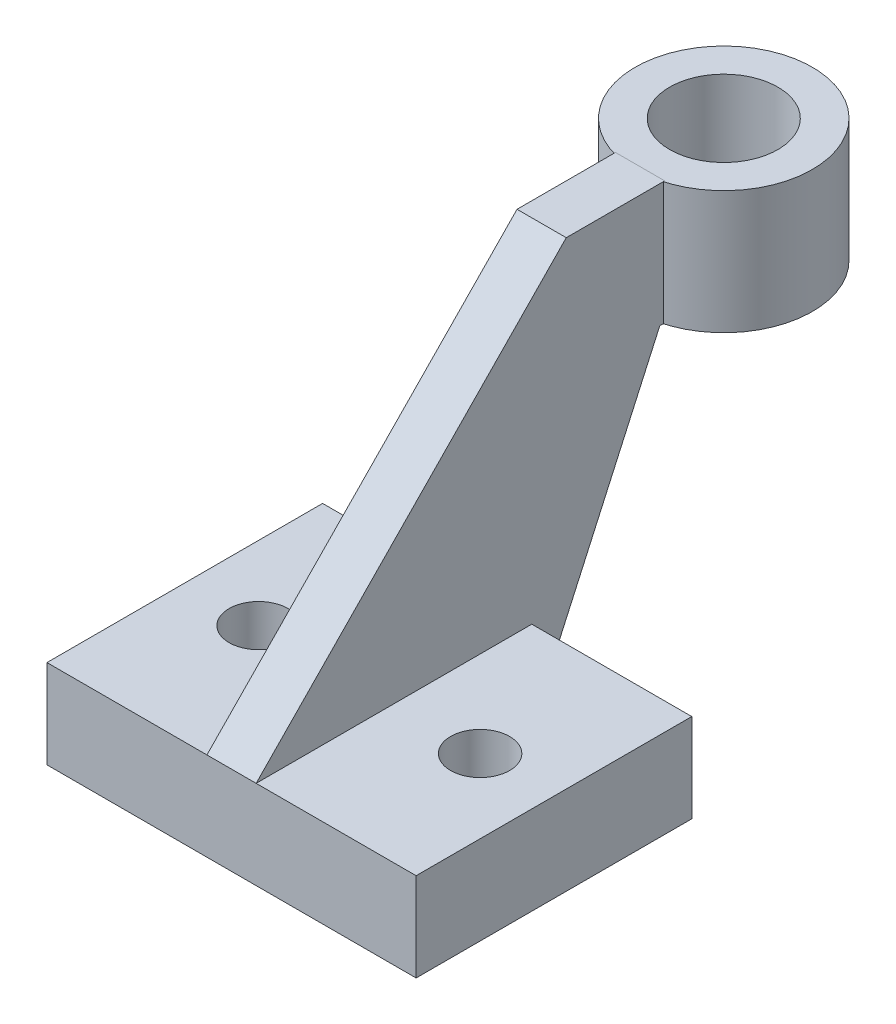
from build123d import *

# Parameters (mm, degrees)
SKETCH1_W           = 56
SKETCH1_H           = 18
BOSS_EXTRUDE1_DEPTH = 37.5
SKETCH3_R           = 18
SKETCH3_R_2         = 11
BOSS_EXTRUDE2_DEPTH = 12.5
BOSS_EXTRUDE3_DEPTH = 5
SKETCH6_W           = 6
SKETCH6_H           = 18.001


with BuildPart() as part:
    # Sketch1 → Boss-Extrude1 (new, symmetric)
    with BuildSketch(Plane(origin=(0, 0, 0), x_dir=(0, 0, -1), z_dir=(1, 0, 0))):
        with Locations((0, 9)):
            Rectangle(SKETCH1_W, SKETCH1_H)
    extrude(amount=BOSS_EXTRUDE1_DEPTH, both=True)

    # Sketch4 → Boss-Extrude3 (add, symmetric)
    with BuildSketch(Plane(origin=(0, 0, 0), x_dir=(0, 0, -1), z_dir=(1, 0, 0))):
        Polygon((-28, 18), (35, 82.5), (55, 82.5), (55, 57.5), (54, 57.5), (28, 0), (28, 18), align=None)
    extrude(amount=BOSS_EXTRUDE3_DEPTH, both=True)

    # Sketch6 → Hole1 (revolve, cut)
    with BuildSketch(Plane(origin=(-22.5, 18, 0), x_dir=(0, 0, 1), z_dir=(1, 0, 0))):
        with Locations((3, 9.0005)):
            Rectangle(SKETCH6_W, SKETCH6_H)
    hole1 = revolve(axis=Axis((-22.5, -92, 0), (0, 1, 0)), mode=Mode.SUBTRACT)

    # Mirror1: Hole1 across plane
    add(hole1.mirror(Plane(origin=(0, 0, 0), x_dir=(0, 0, 1), z_dir=(1, 0, 0))), mode=Mode.SUBTRACT)


with BuildPart() as body_2:
    # Sketch3 → Boss-Extrude2 (new, symmetric)
    with BuildSketch(Plane(origin=(0, 70, 0), x_dir=(1, 0, 0), z_dir=(0, 1, 0))):
        with Locations(Location((0, 72, 0), (0, 0, 270))):
            Circle(SKETCH3_R)
        with Locations(Location((0, 72, 0), (0, 0, 270))):
            Circle(SKETCH3_R_2, mode=Mode.SUBTRACT)
    extrude(amount=BOSS_EXTRUDE2_DEPTH, both=True)


solid = Compound([part.part, body_2.part])
